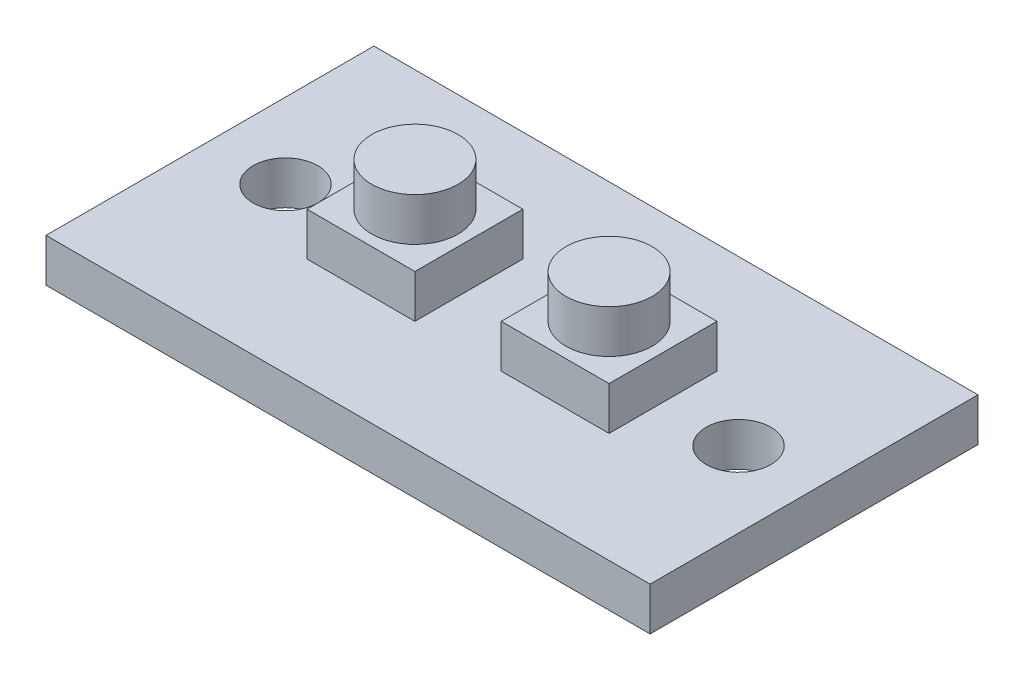
from build123d import *

# Parameters (mm, degrees)
SKETCH_1_W      = 28
SKETCH_1_H      = 15.2
SKETCH_1_R      = 1.5
EXTRUDE_1_DEPTH = 2
SKETCH_2_W      = 5
SKETCH_2_H      = 5
EXTRUDE_2_DEPTH = 2
SKETCH_3_R      = 2
EXTRUDE_3_DEPTH = 2


with BuildPart() as part:
    # 草图1 → 凸台-拉伸1 (new body)
    with BuildSketch(Plane(origin=(0, 0, 0), x_dir=(1, 0, 0), z_dir=(0, 1, 0))):
        Rectangle(SKETCH_1_W, SKETCH_1_H)
        with Locations(Location((10.5, 0, 0), (0, 0, 270))):
            Circle(SKETCH_1_R, mode=Mode.SUBTRACT)
        with Locations(Location((-10.5, 0, 0), (0, 0, 270))):
            Circle(SKETCH_1_R, mode=Mode.SUBTRACT)
    extrude(amount=EXTRUDE_1_DEPTH)

    # 草图2 → 凸台-拉伸2 (add)
    with BuildSketch(Plane(origin=(0, 2, 0), x_dir=(1, 0, 0), z_dir=(0, 1, 0))):
        with Locations((4.5, 0)):
            Rectangle(SKETCH_2_W, SKETCH_2_H)
        with Locations((-4.5, 0)):
            Rectangle(SKETCH_2_W, SKETCH_2_H)
    extrude(amount=EXTRUDE_2_DEPTH)

    # 草图3 → 凸台-拉伸3 (add)
    with BuildSketch(Plane(origin=(0, 4, 0), x_dir=(1, 0, 0), z_dir=(0, 1, 0))):
        with Locations(Location((4.5, 0, 0), (0, 0, 270))):
            Circle(SKETCH_3_R)
        with Locations(Location((-4.5, 0, 0), (0, 0, 90))):
            Circle(SKETCH_3_R)
    extrude(amount=EXTRUDE_3_DEPTH)


solid = part.part
